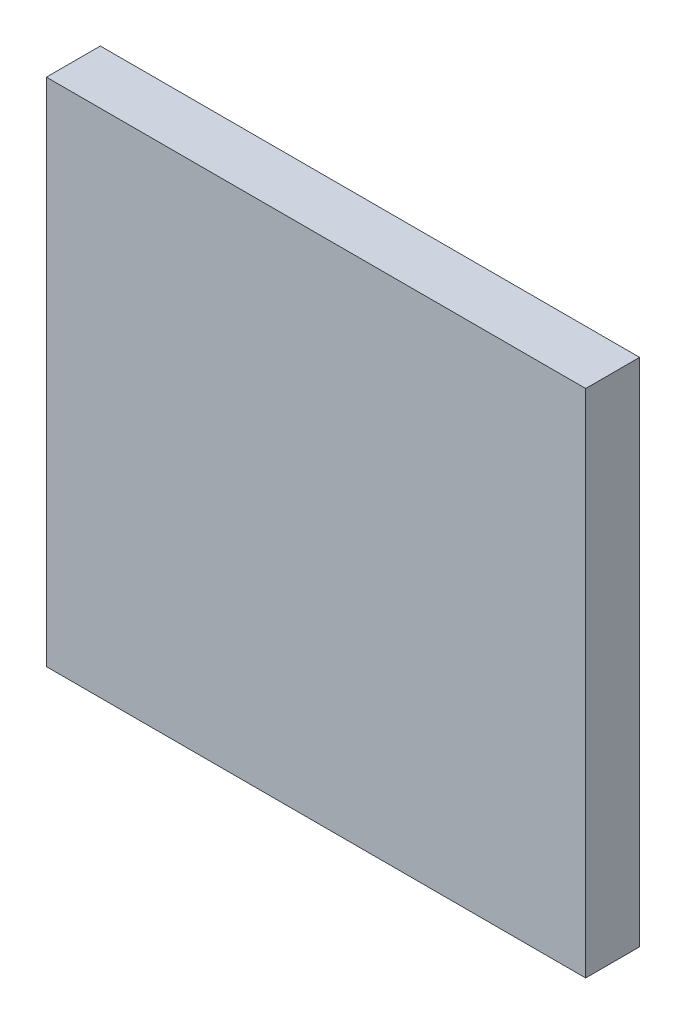
from build123d import *

# Parameters (mm, degrees)
SKETCH1_R                = 19.939
CIRCLE_EXTRUDE_DEPTH     = 12.7
SKETCH3_W                = 12.7
SKETCH3_H                = 39.878
RECTANGLE_EXTRUDE_DEPTH  = 68.58
SKETCH2_R                = 18.034
CRICLE_CUT_DEPTH         = 73.54012766
SKETCH4_OUTSIDE_W        = 110.101
SKETCH4_OUTSIDE_H        = 61.46
SKETCH4_OUTSIDE_W_2      = 66.675
SKETCH4_OUTSIDE_H_2      = 36.068
FRAME_CUT_DEPTH          = 73.54012766
SKETCH13_W               = 5.08
SKETCH13_H               = 36.068
BACK_CUT_DEPTH           = 38.1
SKETCH14_R               = 1.905
FOR_SPRING_EXTRUDE_DEPTH = 2.54
CUT_EXTRUDE1_DEPTH       = 77.861864725


with BuildPart() as part:
    # Sketch1 → circle extrude (new body)
    with BuildSketch(Plane.XY):
        Circle(SKETCH1_R)
    extrude(amount=CIRCLE_EXTRUDE_DEPTH)

    # Sketch3 → rectangle extrude (add)
    with BuildSketch(Plane(origin=(0, 0, 0), x_dir=(0, 0, -1), z_dir=(1, 0, 0))):
        with Locations((-6.35, 0)):
            Rectangle(SKETCH3_W, SKETCH3_H)
    extrude(amount=RECTANGLE_EXTRUDE_DEPTH)

    # Sketch2 → cricle cut (cut, through all)
    with BuildSketch(Plane.XY.offset(12.7)):
        Circle(SKETCH2_R)
    extrude(amount=-CRICLE_CUT_DEPTH, mode=Mode.SUBTRACT)

    # Sketch4 outside → frame cut (cut, through all)
    with BuildSketch(Plane.XY.offset(12.7)):
        with Locations((24.3205, 0)):
            Rectangle(SKETCH4_OUTSIDE_W, SKETCH4_OUTSIDE_H)
        with Locations((33.3375, 0)):
            Rectangle(SKETCH4_OUTSIDE_W_2, SKETCH4_OUTSIDE_H_2, mode=Mode.SUBTRACT)
    extrude(amount=-FRAME_CUT_DEPTH, mode=Mode.SUBTRACT)

    # Sketch13 → back cut (cut)
    with BuildSketch(Plane(origin=(66.675, 0, 0), x_dir=(0, 0, -1), z_dir=(1, 0, 0))):
        with Locations((-6.35, 0)):
            Rectangle(SKETCH13_W, SKETCH13_H)
    extrude(amount=-BACK_CUT_DEPTH, mode=Mode.SUBTRACT)

    # Sketch14 → for spring extrude (add)
    with BuildSketch(Plane(origin=(28.575, 0, 0), x_dir=(0, 0, -1), z_dir=(1, 0, 0))):
        with Locations((-6.35, 0)):
            Circle(SKETCH14_R)
    extrude(amount=FOR_SPRING_EXTRUDE_DEPTH)

    # Sketch15 → Cut-Extrude1 (cut, through all)
    with BuildSketch(Plane(origin=(0, 18.034, 0), x_dir=(1, 0, 0), z_dir=(0, 1, 0))):
        Polygon((28.575, 0), (0, 0), (0, -12.7), (28.575, -12.7), (68.688895239, -12.7), (68.688895239, -4.445), (28.575, -4.445), align=None)
    extrude(amount=-CUT_EXTRUDE1_DEPTH, mode=Mode.SUBTRACT)


solid = part.part
